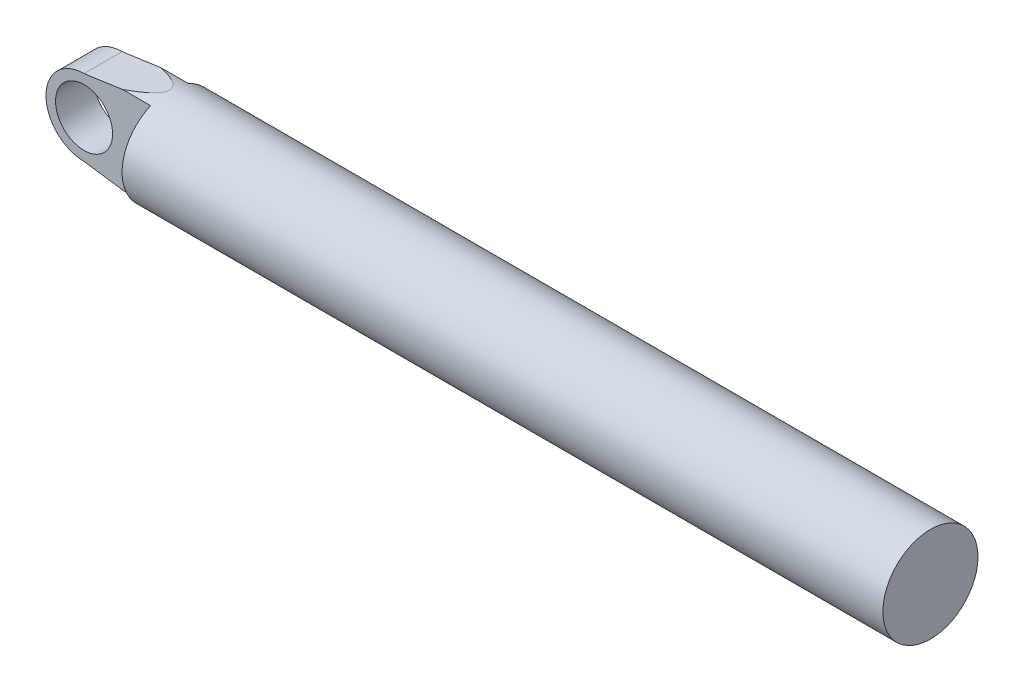
from build123d import *

# Parameters (mm, degrees)
SKETCH1_R                = 25
BOSS_EXTRUDE1_DEPTH      = 400
BOSS_EXTRUDE2_DEPTH      = 10
BOSS_EXTRUDE2_DEPTH_BACK = 10
SKETCH2_R                = 15
CUT_EXTRUDE1_START       = -70
SKETCH3_R                = 32.241288232
SKETCH3_R_2              = 25
CUT_EXTRUDE1_DEPTH       = 70


with BuildPart() as part:
    # Sketch1 → Boss-Extrude1 (new body)
    with BuildSketch(Plane(origin=(0, 0, 0), x_dir=(0, 0, -1), z_dir=(1, 0, 0))):
        Circle(SKETCH1_R)
    extrude(amount=BOSS_EXTRUDE1_DEPTH)

    # Sketch2 → Boss-Extrude2 (add, two sides: drawn at the far end of the back side and taken through both)
    with BuildSketch(Plane.XY.offset(-BOSS_EXTRUDE2_DEPTH_BACK)):
        with BuildLine():
            Line((0, 25), (0, -25))
            Line((0, -25), (-35, -20))
            ThreePointArc((-35, -20), (-55, 0), (-35, 20))
            Line((-35, 20), (0, 25))
        make_face()
        with Locations((-35, 0)):
            Circle(SKETCH2_R, mode=Mode.SUBTRACT)
    extrude(amount=BOSS_EXTRUDE2_DEPTH + BOSS_EXTRUDE2_DEPTH_BACK)

    # Sketch3 → Cut-Extrude1 (cut)
    with BuildSketch(Plane(origin=(0, 0, 0), x_dir=(0, 0, -1), z_dir=(1, 0, 0)).offset(CUT_EXTRUDE1_START)):
        Circle(SKETCH3_R)
        Circle(SKETCH3_R_2, mode=Mode.SUBTRACT)
    extrude(amount=CUT_EXTRUDE1_DEPTH, mode=Mode.SUBTRACT)


solid = part.part
